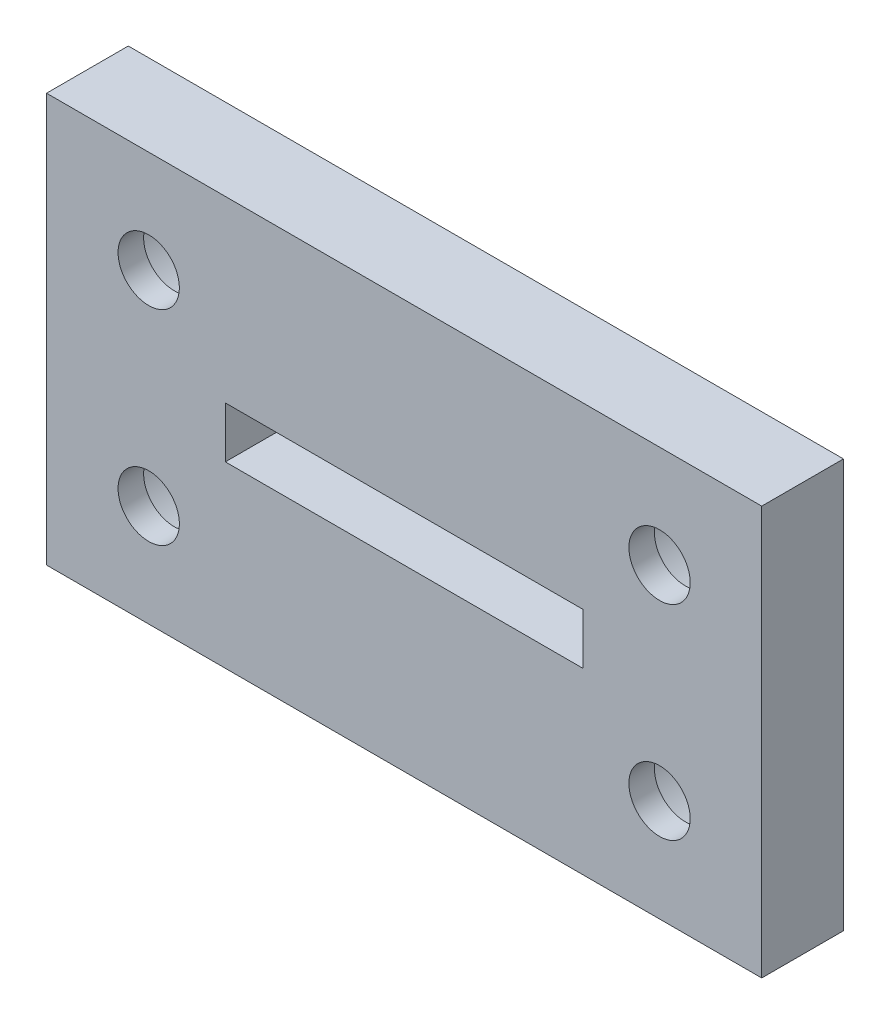
from build123d import *

# Parameters (mm, degrees)
SKETCH1_W           = 28
SKETCH1_H           = 16
SKETCH1_R           = 1.2
SKETCH1_W_2         = 14
SKETCH1_H_2         = 2
BOSS_EXTRUDE1_DEPTH = 3.2
SKETCH2_R           = 3
CUT_EXTRUDE1_DEPTH  = 2.2


with BuildPart() as part:
    # Sketch1 → Boss-Extrude1 (new body)
    with BuildSketch(Plane.XY):
        with Locations((14, 8)):
            Rectangle(SKETCH1_W, SKETCH1_H)
        with Locations((4, 12)):
            Circle(SKETCH1_R, mode=Mode.SUBTRACT)
        with Locations(Location((4, 4, 0), (0, 0, 180))):
            Circle(SKETCH1_R, mode=Mode.SUBTRACT)
        with Locations((24, 4)):
            Circle(SKETCH1_R, mode=Mode.SUBTRACT)
        with Locations(Location((24, 12, 0), (0, 0, 180))):
            Circle(SKETCH1_R, mode=Mode.SUBTRACT)
        with Locations((14, 8)):
            Rectangle(SKETCH1_W_2, SKETCH1_H_2, mode=Mode.SUBTRACT)
    extrude(amount=BOSS_EXTRUDE1_DEPTH)

    # Sketch2 → Cut-Extrude1 (cut)
    with BuildSketch(Plane(origin=(0, 0, 0), x_dir=(-1, 0, 0), z_dir=(0, 0, -1))):
        with Locations((-4, 12)):
            Circle(SKETCH2_R)
        with Locations((-4, 4)):
            Circle(SKETCH2_R)
        with Locations((-24, 4)):
            Circle(SKETCH2_R)
        with Locations((-24, 12)):
            Circle(SKETCH2_R)
    extrude(amount=-CUT_EXTRUDE1_DEPTH, mode=Mode.SUBTRACT)


solid = part.part
